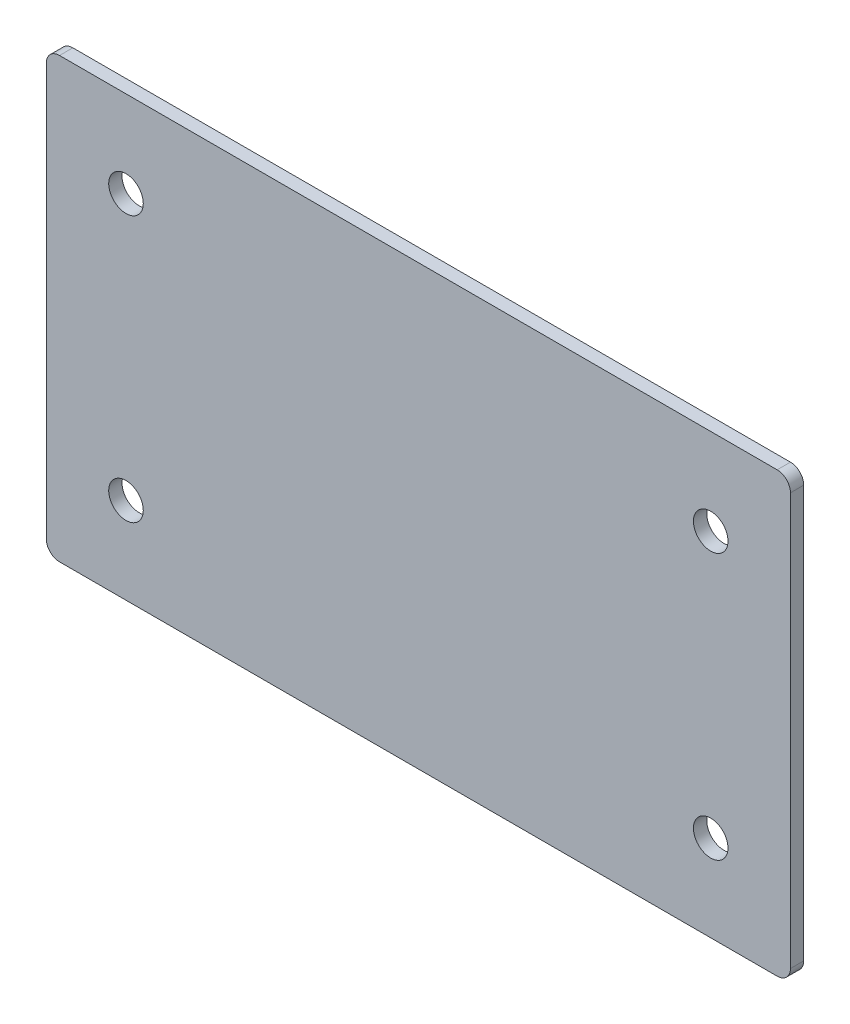
from build123d import *

# Parameters (mm, degrees)
SKETCH_1_W          = 280
SKETCH_1_H          = 165
EXTRUDE_1_DEPTH     = 5
SKETCH_2_R          = 6.5
CUT_EXTRUDE_1_DEPTH = 6
FILLET_1_R          = 5


with BuildPart() as part:
    # 草图1 → 凸台-拉伸1 (new body)
    with BuildSketch(Plane.XY):
        Rectangle(SKETCH_1_W, SKETCH_1_H)
    extrude(amount=EXTRUDE_1_DEPTH)

    # 草图2 → 切除-拉伸1 (cut)
    with BuildSketch(Plane.XY.offset(5)):
        with Locations((-110, 50)):
            Circle(SKETCH_2_R)
        with Locations((110, 50)):
            Circle(SKETCH_2_R)
        with Locations((-110, -50)):
            Circle(SKETCH_2_R)
        with Locations((110, -50)):
            Circle(SKETCH_2_R)
    extrude(amount=-CUT_EXTRUDE_1_DEPTH, mode=Mode.SUBTRACT)

    # 圆角1
    fillet_1_edges = [part.edges().sort_by_distance(p)[0] for p in [
        (140, -82.5, 2.5),
        (-140, -82.5, 2.5),
        (-140, 82.5, 2.5),
        (140, 82.5, 2.5),
    ]]
    fillet(fillet_1_edges, radius=FILLET_1_R)


solid = part.part
